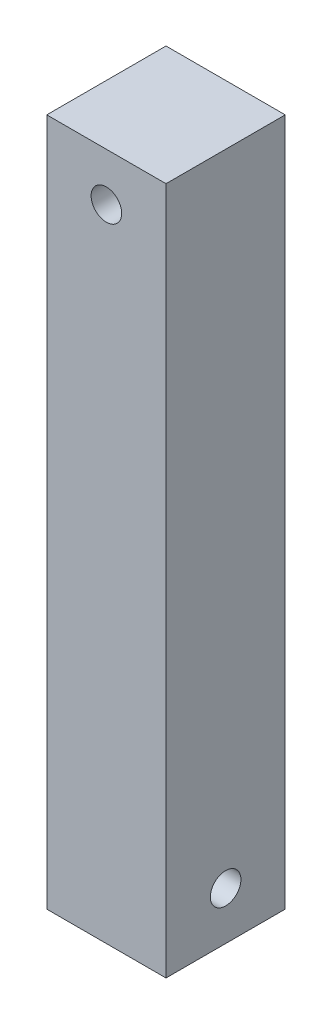
from build123d import *

# Parameters (mm, degrees)
SKETCH1_W           = 11.7
SKETCH1_H           = 11.7
BOSS_EXTRUDE1_DEPTH = 67.5
SKETCH2_R           = 1.5
CUT_EXTRUDE1_DEPTH  = 69.755817936
SKETCH5_W           = 2.779702643
SKETCH5_H           = 3.158753003
CUT_EXTRUDE4_DEPTH  = 10
SKETCH6_R           = 1.5
CUT_EXTRUDE5_DEPTH  = 69.755817936


with BuildPart() as part:
    # Sketch1 → Boss-Extrude1 (new body)
    with BuildSketch(Plane(origin=(0, 0, 0), x_dir=(1, 0, 0), z_dir=(0, 1, 0))):
        Rectangle(SKETCH1_W, SKETCH1_H)
    extrude(amount=BOSS_EXTRUDE1_DEPTH)

    # Sketch2 → Cut-Extrude1 (cut, through all)
    with BuildSketch(Plane.XY.offset(5.85)):
        with Locations((0, 62.8)):
            Circle(SKETCH2_R)
    extrude(amount=-CUT_EXTRUDE1_DEPTH, mode=Mode.SUBTRACT)

    # Sketch5 → Cut-Extrude4 (cut)
    with BuildSketch(Plane(origin=(0, 0, -5.85), x_dir=(-1, 0, 0), z_dir=(0, 0, -1))):
        with Locations((-0.821275781, 15.997808122)):
            Rectangle(SKETCH5_W, SKETCH5_H)
    extrude(amount=-CUT_EXTRUDE4_DEPTH, mode=Mode.SUBTRACT)

    # Sketch6 → Cut-Extrude5 (cut, through all)
    with BuildSketch(Plane(origin=(5.85, 0, 0), x_dir=(0, 0, -1), z_dir=(1, 0, 0))):
        with Locations((0, 4.7)):
            Circle(SKETCH6_R)
    extrude(amount=-CUT_EXTRUDE5_DEPTH, mode=Mode.SUBTRACT)


solid = part.part
